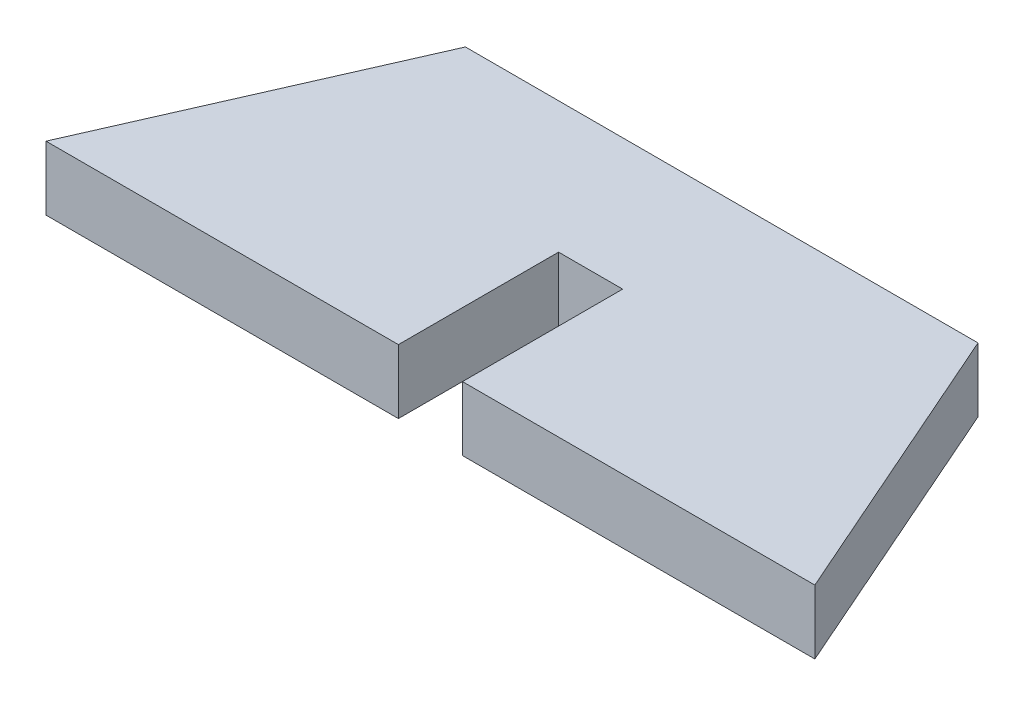
from build123d import *

# Parameters (mm, degrees)
EXTRUDE_1_DEPTH = 10


with BuildPart() as part:
    # Эскиз1 → Бобышка-Вытянуть1 (new body)
    with BuildSketch(Plane(origin=(0, 0, 0), x_dir=(1, 0, 0), z_dir=(0, 1, 0))):
        Polygon((-60, 0), (-5, 0), (-5, 25), (5, 25), (5, 0), (60, 0), (40, 45.461538462), (-40, 45.461538462), align=None)
    extrude(amount=EXTRUDE_1_DEPTH)


solid = part.part
